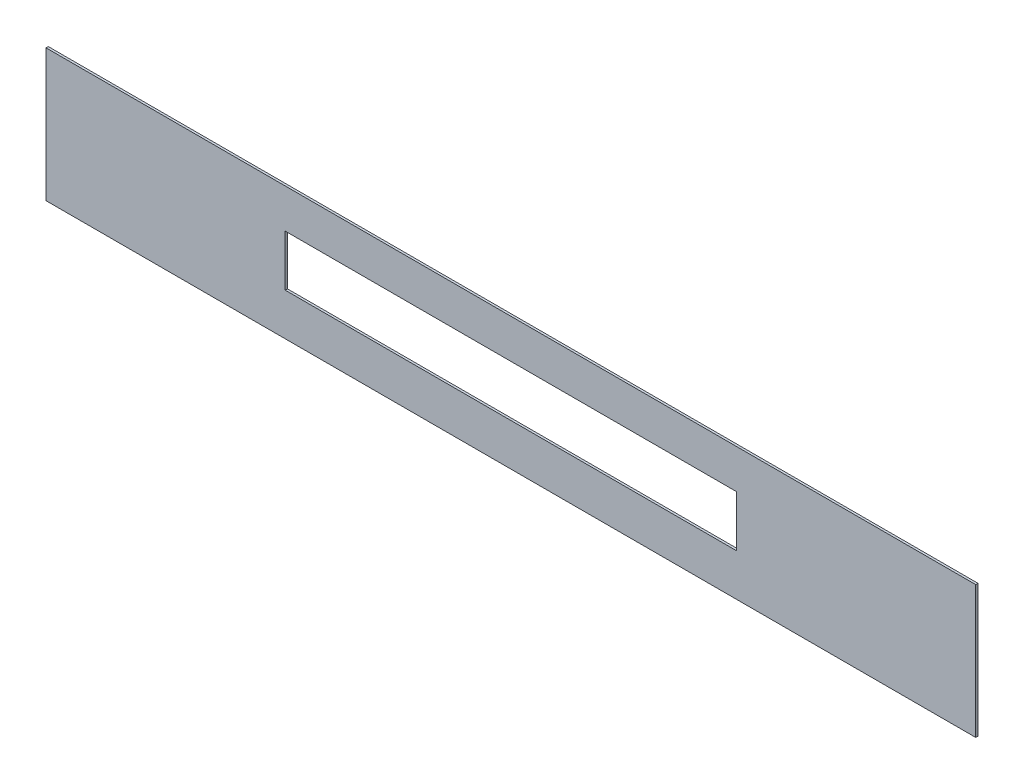
from build123d import *

# Parameters (mm, degrees)
CEK_DONMUS_ON_DIS_SAC_1_5_1_START = 38.5
SKETCH1_W                         = 618
SKETCH1_H                         = 88
CEK_DONMUS_ON_DIS_SAC_1_5_1_DEPTH = 1.5
CEK_DONMUS_ON_DIS_SAC_1_5_2_START = 27
SKETCH2_W                         = 300
SKETCH2_H                         = 34
CEK_DONMUS_ON_DIS_SAC_1_5_2_DEPTH = 14


with BuildPart() as part:
    # Sketch1 → CEK_donmus_on_dis_sac_1.5_1 (new body)
    with BuildSketch(Plane.XY.offset(CEK_DONMUS_ON_DIS_SAC_1_5_1_START)):
        with Locations((309, 44)):
            Rectangle(SKETCH1_W, SKETCH1_H)
    extrude(amount=CEK_DONMUS_ON_DIS_SAC_1_5_1_DEPTH)

    # Sketch2 → CEK_donmus_on_dis_sac_1.5_2 (cut)
    with BuildSketch(Plane.XY.offset(CEK_DONMUS_ON_DIS_SAC_1_5_2_START)):
        with Locations((309, 45)):
            Rectangle(SKETCH2_W, SKETCH2_H)
    extrude(amount=CEK_DONMUS_ON_DIS_SAC_1_5_2_DEPTH, mode=Mode.SUBTRACT)


solid = part.part
